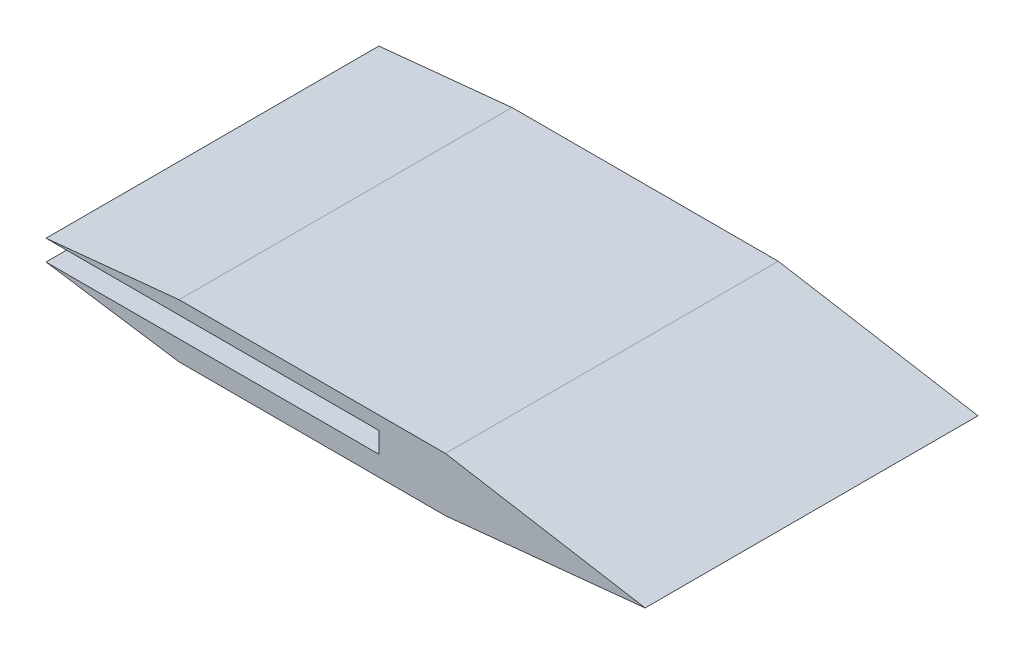
from build123d import *

# Parameters (mm, degrees)
P_IDAT_VYSUNUT_M1_DEPTH = 50


with BuildPart() as part:
    # Skica1 → Přidat vysunutím1 (new body)
    with BuildSketch(Plane.XY):
        Polygon((0, 0), (20, 2), (60, 2), (90, -3.1), (60, -6.1), (20, -6.1), (0, -3.1), (50, -3.1), (50, 0), align=None)
    extrude(amount=P_IDAT_VYSUNUT_M1_DEPTH)


solid = part.part
